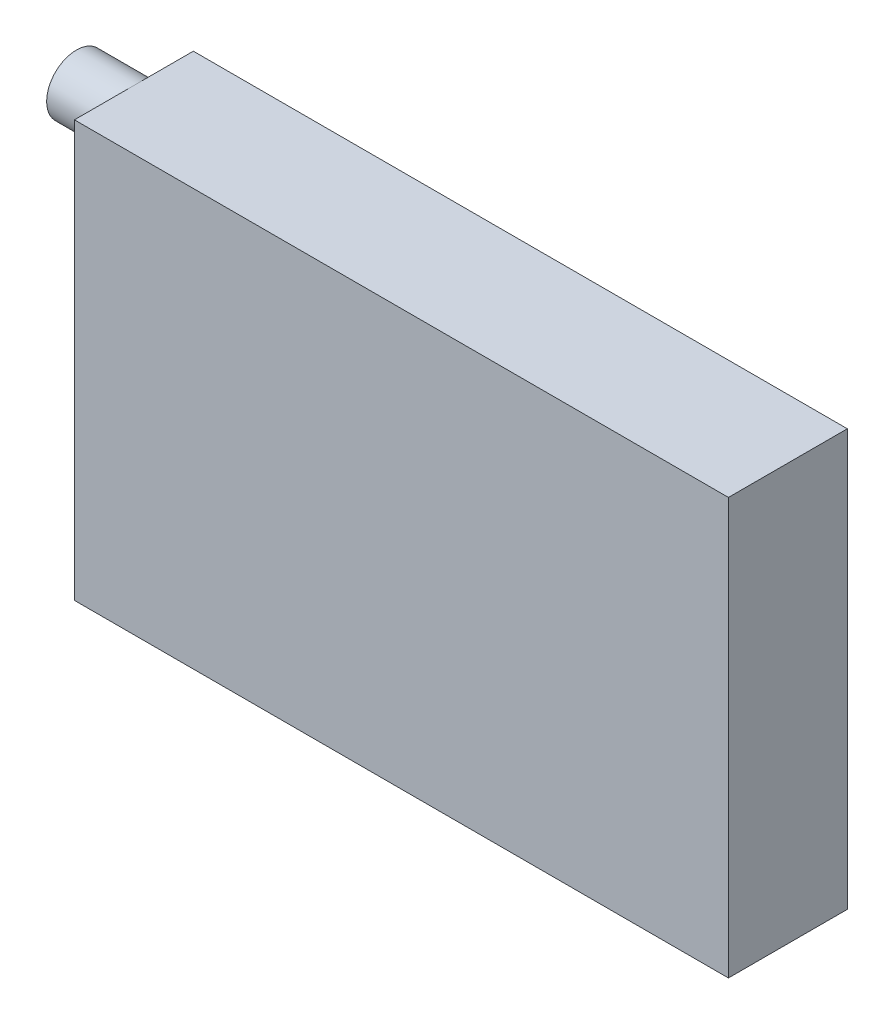
from build123d import *

# Parameters (mm, degrees)
SKETCH_1_W      = 110
SKETCH_1_H      = 70
EXTRUDE_1_DEPTH = 20
SKETCH_2_R      = 5
EXTRUDE_2_DEPTH = 10


with BuildPart() as part:
    # 草图1 → 凸台-拉伸1 (new body)
    with BuildSketch(Plane.XY):
        Rectangle(SKETCH_1_W, SKETCH_1_H)
    extrude(amount=EXTRUDE_1_DEPTH)

    # 草图2 → 凸台-拉伸2 (add)
    with BuildSketch(Plane.ZY.offset(55)):
        with Locations(Location((9.669244668, 30, 0), (0, 0, 90))):
            Circle(SKETCH_2_R)
    extrude(amount=EXTRUDE_2_DEPTH)


solid = part.part
